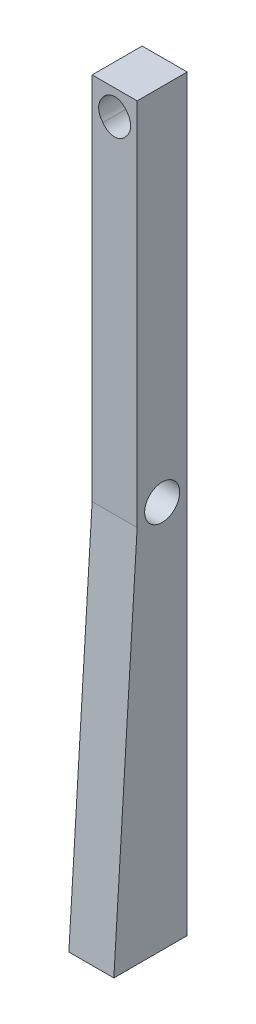
from build123d import *

# Parameters (mm, degrees)
BOSS_EXTRU_1_DEPTH      = 10
ESQUISSE3_W             = 9
ESQUISSE3_H             = 75.66
BOSS_EXTRU_2_DEPTH      = 7
ENL_V_MAT_EXTRU_1_DEPTH = 13
ESQUISSE5_RX            = 3.5
ESQUISSE5_RY            = 3
ENL_V_MAT_EXTRU_2_DEPTH = 13
ESQUISSE6_R             = 3.2
ENL_V_MAT_EXTRU_3_DEPTH = 13
ESQUISSE7_R             = 3.5
ENL_V_MAT_EXTRU_4_DEPTH = 13


with BuildPart() as part:
    # Esquisse2 → Boss.-Extru.1 (new body)
    with BuildSketch(Plane.XY):
        Polygon((-14.475776368, 301.567147766), (-14.475776368, 373.567147766), (-5.475776368, 373.567147766), (-5.475776368, 301.567147766), (-5.475776368, 224.004578109), (-14.475776368, 224.004578109), align=None)
    extrude(amount=BOSS_EXTRU_1_DEPTH)

    # Esquisse3 → Boss.-Extru.2 (add)
    with BuildSketch(Plane.XY.offset(10)):
        with Locations((-9.975776368, 261.834578109)):
            Rectangle(ESQUISSE3_W, ESQUISSE3_H)
    extrude(amount=BOSS_EXTRU_2_DEPTH)

    # Esquisse4 → Enlèv. mat.-Extru.1 (cut)
    with BuildSketch(Plane(origin=(-5.475776368, 0, 0), x_dir=(0, 0, -1), z_dir=(1, 0, 0))):
        Polygon((-10, 299.664578109), (-14.659103262, 224.004578109), (-17, 224.004578109), (-17, 299.664578109), align=None)
    extrude(amount=-ENL_V_MAT_EXTRU_1_DEPTH, mode=Mode.SUBTRACT)

    # Esquisse5 → Enlèv. mat.-Extru.2 (cut)
    with BuildSketch(Plane.XY.offset(10)):
        with Locations(Location((-9.975776368, 368.567147766), (0, 0, 90))):
            Ellipse(ESQUISSE5_RX, ESQUISSE5_RY)
    extrude(amount=-ENL_V_MAT_EXTRU_2_DEPTH, mode=Mode.SUBTRACT)

    # Esquisse6 → Enlèv. mat.-Extru.3 (cut)
    with BuildSketch(Plane.XY.offset(10)):
        with Locations((-9.975776368, 368.567147766)):
            Circle(ESQUISSE6_R)
    extrude(amount=-ENL_V_MAT_EXTRU_3_DEPTH, mode=Mode.SUBTRACT)

    # Esquisse7 → Enlèv. mat.-Extru.4 (cut)
    with BuildSketch(Plane(origin=(-5.475776368, 0, 0), x_dir=(0, 0, -1), z_dir=(1, 0, 0))):
        with Locations((-5, 301.567147766)):
            Circle(ESQUISSE7_R)
    extrude(amount=-ENL_V_MAT_EXTRU_4_DEPTH, mode=Mode.SUBTRACT)


solid = part.part
